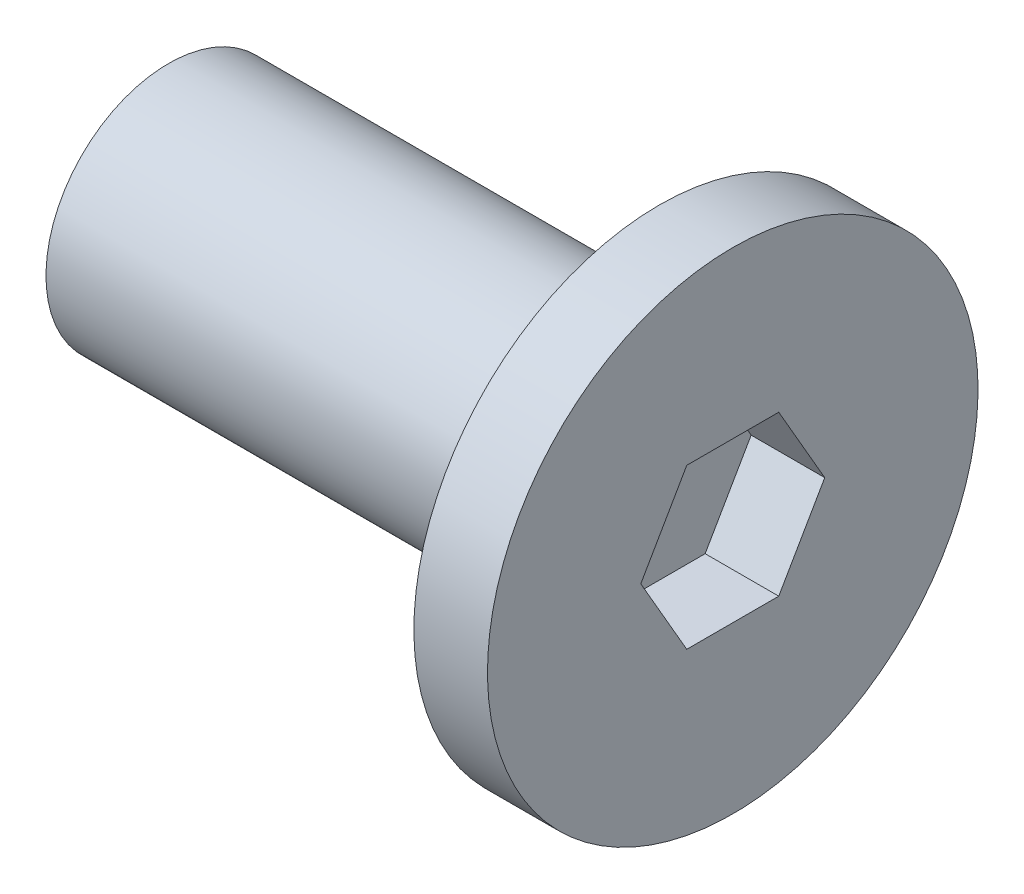
from build123d import *

# Parameters (mm, degrees)
SKETCH_1_W          = 1.2
SKETCH_1_H          = 4
SKETCH_2_R          = 2
EXTRUDE_1_DEPTH     = 8
CUT_EXTRUDE_1_DEPTH = 1.2


with BuildPart() as part:
    # 草图1 → 旋转1 (revolve)
    with BuildSketch(Plane.XY):
        with Locations((-0.6, 2)):
            Rectangle(SKETCH_1_W, SKETCH_1_H)
    revolve(axis=Axis((0, 0, 0), (-1, 0, 0)))

    # 草图2 → 凸台-拉伸1 (add)
    with BuildSketch(Plane.ZY.offset(1.2)):
        with Locations(Location((0, 0, 0), (0, 0, 270))):
            Circle(SKETCH_2_R)
    extrude(amount=EXTRUDE_1_DEPTH)

    # 草图3 → 切除-拉伸1 (cut)
    with BuildSketch(Plane(origin=(0, 0, 0), x_dir=(0, 0, -1), z_dir=(1, 0, 0))):
        Polygon((0.75, 1.299038106), (-0.75, 1.299038106), (-1.5, 0), (-0.75, -1.299038106), (0.75, -1.299038106), (1.5, 0), align=None)
    extrude(amount=-CUT_EXTRUDE_1_DEPTH, mode=Mode.SUBTRACT)


solid = part.part
